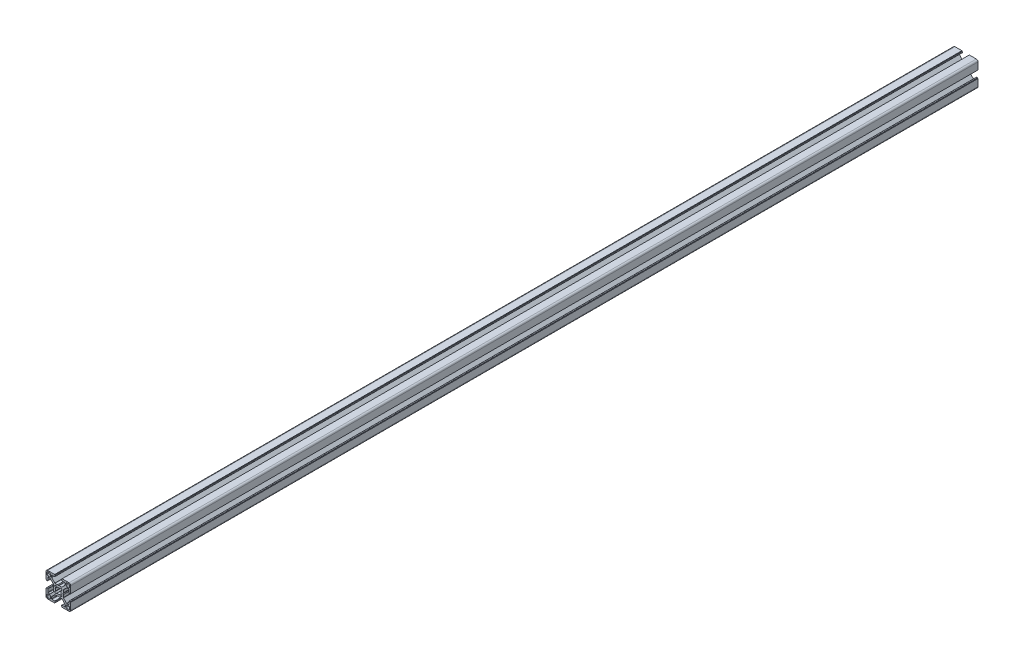
from build123d import *

# Parameters (mm, degrees)
BOSS_EXTRUDE1_DEPTH = 550
CIRPATTERN1_COUNT   = 4


with BuildPart() as part:
    # Sketch3 → Boss-Extrude1 (new, symmetric)
    with BuildSketch(Plane.XY):
        with BuildLine():
            Line((-4.503841895, 3.156803476), (-3.14772708, 1.530298739))
            ThreePointArc((-3.14772708, 1.530298739), (-3.410794979, 0.785160882), (-3.5, 0))
            Line((-3.5, 0), (-5.5, 0))
            Line((-5.5, 0), (-6, 0.866025404))
            Line((-6, 0.866025404), (-6, 3.996841995))
            ThreePointArc((-6, 3.996841995), (-6.038060234, 4.188183711), (-6.146446609, 4.350395385))
            Line((-6.146446609, 4.350395385), (-9.917104615, 8.121053391))
            ThreePointArc((-9.917104615, 8.121053391), (-10.079316289, 8.229439766), (-10.270658005, 8.2675))
            Line((-10.270658005, 8.2675), (-12.29, 8.2675))
            ThreePointArc((-12.29, 8.2675), (-12.643553391, 8.121053391), (-12.79, 7.7675))
            Line((-12.79, 7.7675), (-12.79, 4.5))
            ThreePointArc((-12.79, 4.5), (-12.936446609, 4.146446609), (-13.29, 4))
            Line((-13.29, 4), (-14.5, 4))
            Line((-14.5, 4), (-14.5, 4.5))
            Line((-14.5, 4.5), (-15, 4.5))
            Line((-15, 4.5), (-15, 12.968))
            ThreePointArc((-15, 12.968), (-14.404840979, 14.404840979), (-12.968, 15))
            Line((-12.968, 15), (-4.5, 15))
            Line((-4.5, 15), (-4.5, 14.5))
            Line((-4.5, 14.5), (-4, 14.5))
            Line((-4, 14.5), (-4, 13.29))
            ThreePointArc((-4, 13.29), (-4.146446609, 12.936446609), (-4.5, 12.79))
            Line((-4.5, 12.79), (-7.7675, 12.79))
            ThreePointArc((-7.7675, 12.79), (-8.121053391, 12.643553391), (-8.2675, 12.29))
            Line((-8.2675, 12.29), (-8.2675, 10.270658005))
            ThreePointArc((-8.2675, 10.270658005), (-8.229439766, 10.079316289), (-8.121053391, 9.917104615))
            Line((-8.121053391, 9.917104615), (-4.350395385, 6.146446609))
            ThreePointArc((-4.350395385, 6.146446609), (-4.188183711, 6.038060234), (-3.996841995, 6))
            Line((-3.996841995, 6), (-0.866025404, 6))
            Line((-0.866025404, 6), (0, 5.5))
            Line((0, 5.5), (0, 3.5))
            ThreePointArc((0, 3.5), (-0.785160882, 3.410794979), (-1.530298739, 3.14772708))
            Line((-1.530298739, 3.14772708), (-3.156803476, 4.503841895))
            ThreePointArc((-3.156803476, 4.503841895), (-3.889087297, 3.889087297), (-4.503841895, 3.156803476))
        make_face()
        with BuildLine():
            Line((-12.705, 9.5135), (-10.5135, 9.5135))
            ThreePointArc((-10.5135, 9.5135), (-9.806393219, 9.806393219), (-9.5135, 10.5135))
            Line((-9.5135, 10.5135), (-9.5135, 12.705))
            ThreePointArc((-9.5135, 12.705), (-9.806393219, 13.412106781), (-10.5135, 13.705))
            Line((-10.5135, 13.705), (-12.705, 13.705))
            ThreePointArc((-12.705, 13.705), (-13.412106781, 13.412106781), (-13.705, 12.705))
            Line((-13.705, 12.705), (-13.705, 10.5135))
            ThreePointArc((-13.705, 10.5135), (-13.412106781, 9.806393219), (-12.705, 9.5135))
        make_face(mode=Mode.SUBTRACT)
    boss_extrude1 = extrude(amount=BOSS_EXTRUDE1_DEPTH, both=True)

    # CirPattern1: Boss-Extrude1 ×4 about axis
    cirpattern1_axis = Axis((0, 0, 0), (0, 0, 1))
    for i in range(1, CIRPATTERN1_COUNT):
        add(boss_extrude1.rotate(cirpattern1_axis, i * 360 / CIRPATTERN1_COUNT))


solid = part.part
